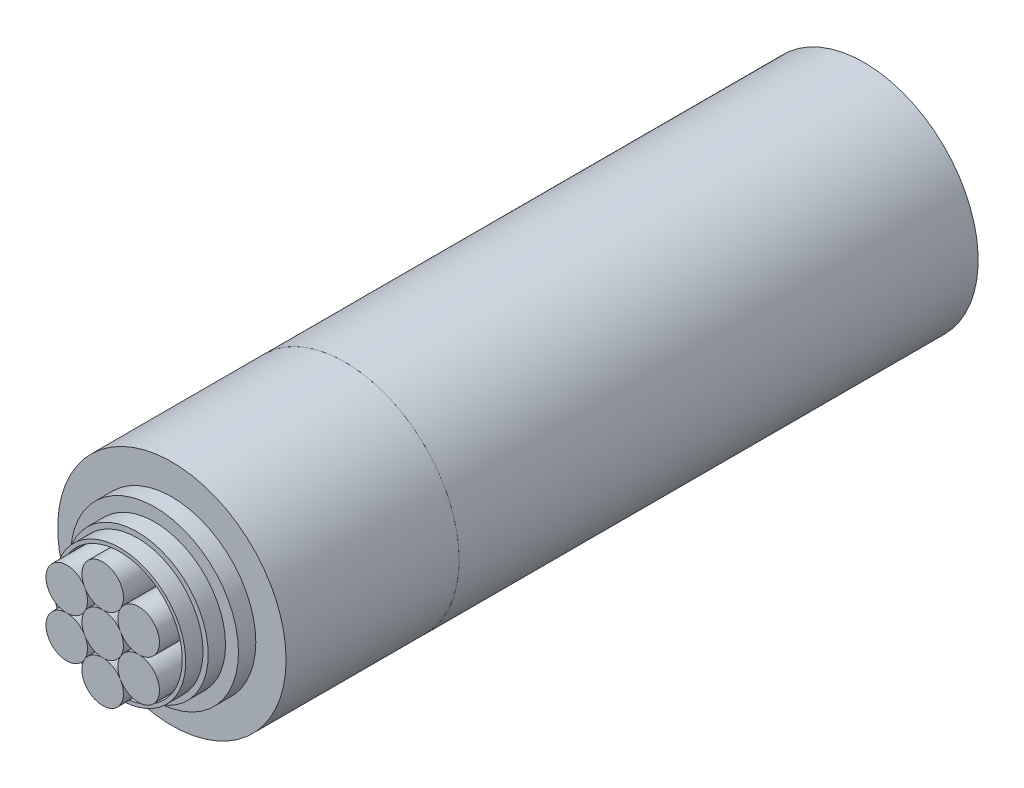
from build123d import *

# Parameters (mm, degrees)
IZIM1_R                       = 6.6
IZIM1_R_2                     = 4.85
Y_KSEKLIK_EKSTR_ZYON1_DEPTH   = 10
IZIM1_5_R                     = 4.85
IZIM1_5_R_2                   = 4.1
Y_KSEKLIK_EKSTR_ZYON2_DEPTH   = 11
IZIM1_6_R                     = 4.1
IZIM1_6_R_2                   = 3.8
Y_KSEKLIK_EKSTR_ZYON3_DEPTH   = 12
IZIM1_7_R                     = 3.8
Y_KSEKLIK_EKSTR_ZYON4_DEPTH   = 13
Y_KSEKLIK_EKSTR_ZYON5_DEPTH   = 14
Y_KSEKLIK_EKSTR_ZYON5_2_DEPTH = 14
Y_KSEKLIK_EKSTR_ZYON5_3_DEPTH = 14
Y_KSEKLIK_EKSTR_ZYON5_4_DEPTH = 14
Y_KSEKLIK_EKSTR_ZYON5_5_DEPTH = 14
Y_KSEKLIK_EKSTR_ZYON5_6_DEPTH = 14
Y_KSEKLIK_EKSTR_ZYON5_7_DEPTH = 14
L_EK6_SCALE                   = 0.5
IZIM3_R                       = 3.3
Y_KSEKLIK_EKSTR_ZYON8_DEPTH   = 15


with BuildPart() as part:
    # Çizim1 → Yükseklik-Ekstrüzyon1 (new body)
    with BuildSketch(Plane.XY):
        Circle(IZIM1_R)
        Circle(IZIM1_R_2, mode=Mode.SUBTRACT)
    extrude(amount=Y_KSEKLIK_EKSTR_ZYON1_DEPTH)

    # Çizim1<5> → Yükseklik-Ekstrüzyon2 (add)
    with BuildSketch(Plane.XY):
        Circle(IZIM1_5_R)
        Circle(IZIM1_5_R_2, mode=Mode.SUBTRACT)
    extrude(amount=Y_KSEKLIK_EKSTR_ZYON2_DEPTH)

    # Çizim1<6> → Yükseklik-Ekstrüzyon3 (add)
    with BuildSketch(Plane.XY):
        Circle(IZIM1_6_R)
        Circle(IZIM1_6_R_2, mode=Mode.SUBTRACT)
    extrude(amount=Y_KSEKLIK_EKSTR_ZYON3_DEPTH)

    # Çizim1<7> → Yükseklik-Ekstrüzyon4 (add)
    with BuildSketch(Plane.XY):
        Circle(IZIM1_7_R)
        with BuildLine():
            ThreePointArc((1e-09, 3.6), (1.799999837, 3.117691548), (3.117691265, 1.800000327))
            ThreePointArc((3.117691265, 1.800000327), (3.477332926, 0.931748744), (3.6, 0))
            ThreePointArc((3.6, 0), (3.477333, -0.931748466), (3.117691553, -1.799999828))
            ThreePointArc((3.117691553, -1.799999828), (1.800000078, -3.117691408), (-1.8e-08, -3.6))
            ThreePointArc((-1.8e-08, -3.6), (-1.800000027, -3.117691438), (-3.117691475, -1.799999962))
            ThreePointArc((-3.117691475, -1.799999962), (-3.6, 2.09e-07), (-3.117691266, 1.800000324))
            ThreePointArc((-3.117691266, 1.800000324), (-1.799999837, 3.117691547), (1e-09, 3.6))
        make_face(mode=Mode.SUBTRACT)
    extrude(amount=Y_KSEKLIK_EKSTR_ZYON4_DEPTH)


with BuildPart() as body_2:
    # Çizim1<8> → Yükseklik-Ekstrüzyon5 (new body)
    with BuildSketch(Plane.XY):
        with BuildLine():
            ThreePointArc((1.039230332, -0.600000264), (1.2, -2.6e-08), (1.039230358, 0.600000219))
            ThreePointArc((1.039230358, 0.600000219), (0.599999889, 1.039230548), (-2e-09, 1.2))
            ThreePointArc((-2e-09, 1.2), (-0.599999999, 1.039230485), (-1.039230482, 0.600000005))
            ThreePointArc((-1.039230482, 0.600000005), (-1.2, 6.3e-08), (-1.039230545, -0.599999895))
            ThreePointArc((-1.039230545, -0.599999895), (-0.600000053, -1.039230454), (0, -1.2))
            ThreePointArc((0, -1.2), (0.599999868, -1.039230561), (1.039230332, -0.600000264))
        make_face()
    extrude(amount=Y_KSEKLIK_EKSTR_ZYON5_DEPTH)


with BuildPart() as body_3:
    # Çizim1<8> → Y_kseklik-Ekstr_zyon5 2 (new body)
    with BuildSketch(Plane.XY):
        with BuildLine():
            ThreePointArc((1.039230359, 1.799999783), (0.878460969, 1.200000001), (1.039230358, 0.600000219))
            ThreePointArc((1.039230358, 0.600000219), (1.47846086, 0.160769579), (2.078460969, 0))
            ThreePointArc((2.078460969, 0), (3.117691391, 1.800000109), (1.039230359, 1.799999783))
        make_face()
    extrude(amount=Y_KSEKLIK_EKSTR_ZYON5_2_DEPTH)


with BuildPart() as body_4:
    # Çizim1<8> → Y_kseklik-Ekstr_zyon5 3 (new body)
    with BuildSketch(Plane.XY):
        with BuildLine():
            ThreePointArc((2.078460969, 0), (1.478460837, -0.160769592), (1.039230332, -0.600000264))
            ThreePointArc((1.039230332, -0.600000264), (0.878460969, -1.20000028), (1.039230612, -1.800000221))
            ThreePointArc((1.039230612, -1.800000221), (3.117691518, -1.799999889), (2.078460969, 0))
        make_face()
    extrude(amount=Y_KSEKLIK_EKSTR_ZYON5_3_DEPTH)


with BuildPart() as body_5:
    # Çizim1<8> → Y_kseklik-Ekstr_zyon5 4 (new body)
    with BuildSketch(Plane.XY):
        with BuildLine():
            ThreePointArc((-1.039230399, 1.799999852), (-0.599999927, 1.360769473), (-2e-09, 1.2))
            ThreePointArc((-2e-09, 1.2), (0.59999989, 1.360769452), (1.039230359, 1.799999783))
            ThreePointArc((1.039230359, 1.799999783), (4e-08, 3.6), (-1.039230399, 1.799999852))
        make_face()
    extrude(amount=Y_KSEKLIK_EKSTR_ZYON5_4_DEPTH)


with BuildPart() as body_6:
    # Çizim1<8> → Y_kseklik-Ekstr_zyon5 5 (new body)
    with BuildSketch(Plane.XY):
        with BuildLine():
            ThreePointArc((1.039230612, -1.800000221), (0.600000111, -1.360769579), (0, -1.2))
            ThreePointArc((0, -1.2), (-0.59999994, -1.360769481), (-1.039230415, -1.79999988))
            ThreePointArc((-1.039230415, -1.79999988), (-1.97e-07, -3.6), (1.039230612, -1.800000221))
        make_face()
    extrude(amount=Y_KSEKLIK_EKSTR_ZYON5_5_DEPTH)


with BuildPart() as body_7:
    # Çizim1<8> → Y_kseklik-Ekstr_zyon5 6 (new body)
    with BuildSketch(Plane.XY):
        with BuildLine():
            ThreePointArc((-2.078460966, 0), (-1.478460966, 0.160769517), (-1.039230482, 0.600000005))
            ThreePointArc((-1.039230482, 0.600000005), (-0.878460969, 1.199999917), (-1.039230399, 1.799999852))
            ThreePointArc((-1.039230399, 1.799999852), (-3.117691412, 1.800000073), (-2.078460966, 0))
        make_face()
    extrude(amount=Y_KSEKLIK_EKSTR_ZYON5_6_DEPTH)


with BuildPart() as body_8:
    # Çizim1<8> → Y_kseklik-Ekstr_zyon5 7 (new body)
    with BuildSketch(Plane.XY):
        with BuildLine():
            ThreePointArc((-1.039230415, -1.79999988), (-0.878460969, -1.19999987), (-1.039230545, -0.599999895))
            ThreePointArc((-1.039230545, -0.599999895), (-1.47846102, -0.160769486), (-2.078460966, 0))
            ThreePointArc((-2.078460966, 0), (-3.11769142, -1.800000059), (-1.039230415, -1.79999988))
        make_face()
    extrude(amount=Y_KSEKLIK_EKSTR_ZYON5_7_DEPTH)


with BuildPart() as body_4_1:
    # Ölçek6: scaled about (0, 0, 0)
    add(body_4.part.scale(L_EK6_SCALE))


with BuildPart() as body_6_1:
    # Ölçek6: scaled about (0, 0, 0)
    add(body_6.part.scale(L_EK6_SCALE))


with BuildPart() as body_8_1:
    # Ölçek6: scaled about (0, 0, 0)
    add(body_8.part.scale(L_EK6_SCALE))


with BuildPart() as body_7_1:
    # Ölçek6: scaled about (0, 0, 0)
    add(body_7.part.scale(L_EK6_SCALE))


with BuildPart() as body_2_1:
    # Ölçek6: scaled about (0, 0, 0)
    add(body_2.part.scale(L_EK6_SCALE))


with BuildPart() as body_3_1:
    # Ölçek6: scaled about (0, 0, 0)
    add(body_3.part.scale(L_EK6_SCALE))


with BuildPart() as body_5_1:
    # Ölçek6: scaled about (0, 0, 0)
    add(body_5.part.scale(L_EK6_SCALE))


with BuildPart() as part_1:
    # Ölçek6: scaled about (0, 0, 0)
    add(part.part.scale(L_EK6_SCALE))


with BuildPart() as body_9:
    # Çizim3 → Yükseklik-Ekstrüzyon8 (new body)
    with BuildSketch(Plane(origin=(0, 0, 0), x_dir=(-1, 0, 0), z_dir=(0, 0, -1))):
        Circle(IZIM3_R)
    extrude(amount=Y_KSEKLIK_EKSTR_ZYON8_DEPTH)


solid = Compound([body_4_1.part, body_6_1.part, body_8_1.part, body_7_1.part, body_2_1.part, body_3_1.part, body_5_1.part, part_1.part, body_9.part])
